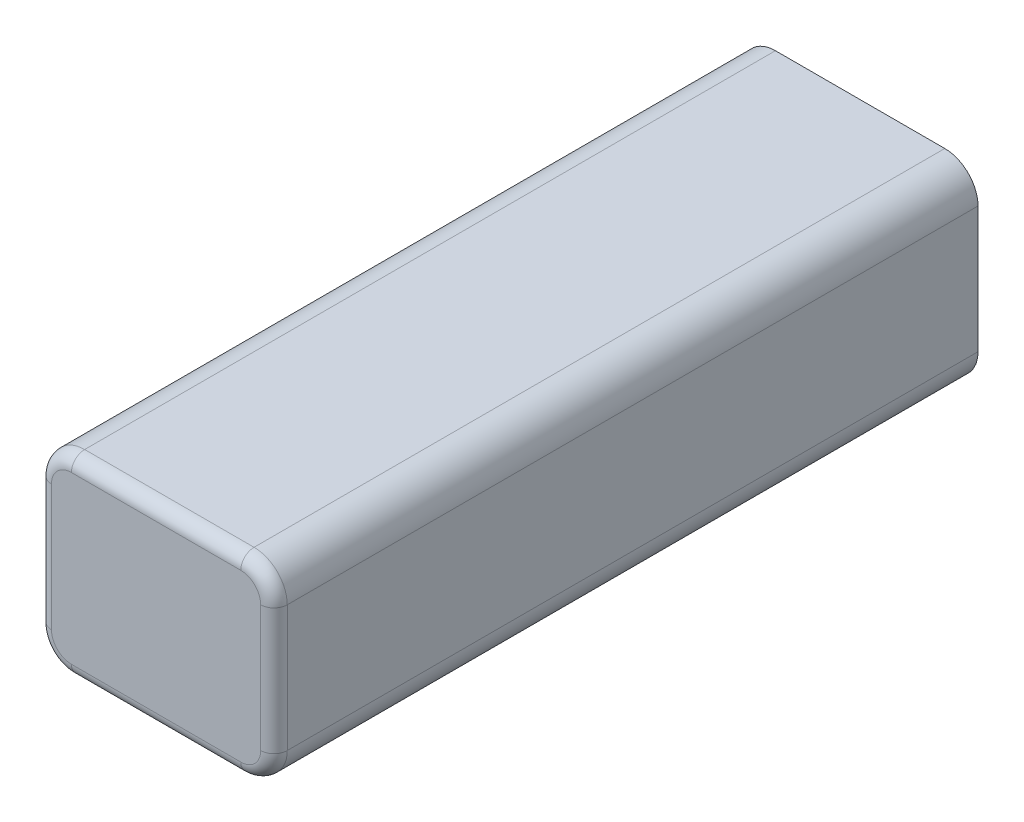
from build123d import *

# Parameters (mm, degrees)
SKETCH_1_W      = 35.5
SKETCH_1_H      = 29
EXTRUDE_1_DEPTH = 106
FILLET_1_R      = 5
FILLET_2_R      = 2


with BuildPart() as part:
    # 草图1 → 凸台-拉伸1 (new body)
    with BuildSketch(Plane.XY):
        Rectangle(SKETCH_1_W, SKETCH_1_H)
    extrude(amount=EXTRUDE_1_DEPTH)

    # 圆角1
    fillet_1_edges = [part.edges().sort_by_distance(p)[0] for p in [
        (17.75, -14.5, 53),
        (-17.75, -14.5, 53),
        (-17.75, 14.5, 53),
        (17.75, 14.5, 53),
    ]]
    fillet(fillet_1_edges, radius=FILLET_1_R)

    # 圆角2
    fillet_2_edges = [part.edges().sort_by_distance(p)[0] for p in [
        (17.75, 0, 106),
        (0, -14.5, 106),
        (0, 14.5, 106),
        (-17.75, 0, 106),
        (16.285533906, 13.035533906, 106),
        (-16.285533906, 13.035533906, 106),
        (-16.285533906, -13.035533906, 106),
        (16.285533906, -13.035533906, 106),
    ]]
    fillet(fillet_2_edges, radius=FILLET_2_R)


solid = part.part
